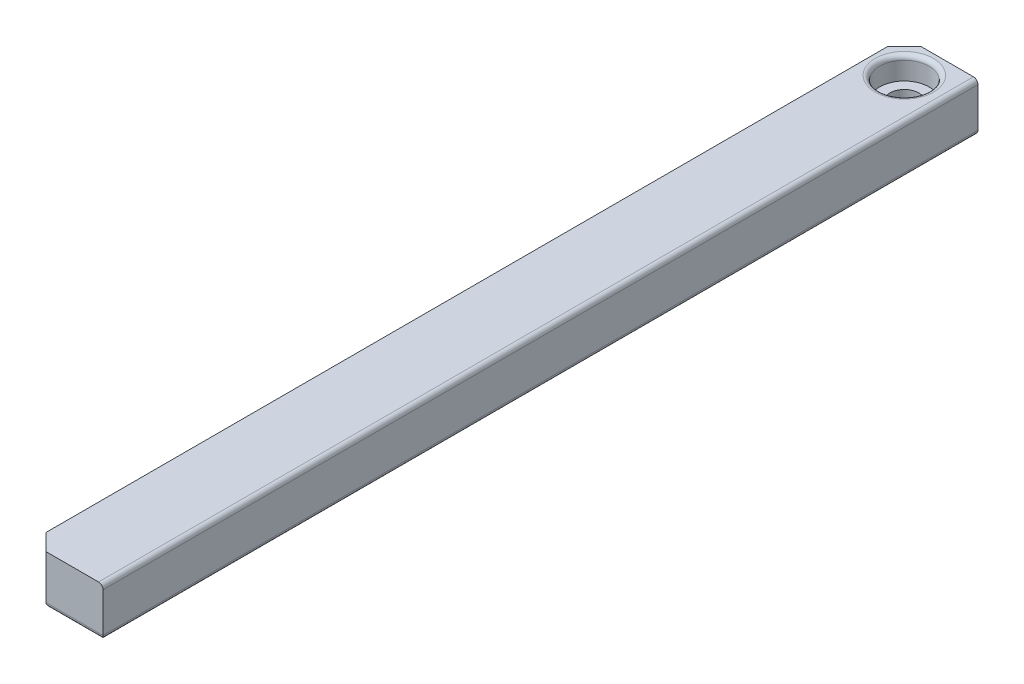
from build123d import *

# Parameters (mm, degrees)
SKETCH_1_W          = 8.2
SKETCH_1_H          = 97.4
EXTRUDE_1_DEPTH     = 5.4
SKETCH_2_R          = 1.6
CUT_EXTRUDE_1_DEPTH = 103.046451594
FILLET_1_R          = 0.5
FILLET_2_R          = 0.5
SKETCH_3_R          = 2.75
CUT_EXTRUDE_2_DEPTH = 2.5
FILLET_3_R          = 0.5


with BuildPart() as part:
    # 草图1 → 凸台-拉伸1 (new body)
    with BuildSketch(Plane(origin=(0, 0, 0), x_dir=(1, 0, 0), z_dir=(0, 1, 0))):
        with Locations((25.859277076, 48.7)):
            Rectangle(SKETCH_1_W, SKETCH_1_H)
    extrude(amount=EXTRUDE_1_DEPTH)

    # 草图2 → 切除-拉伸1 (cut, through all)
    with BuildSketch(Plane(origin=(0, 5.4, 0), x_dir=(1, 0, 0), z_dir=(0, 1, 0))):
        with Locations(Location((25.459277076, 93.7, 0), (0, 0, 270))):
            Circle(SKETCH_2_R)
        Polygon((21.759277076, 97.4), (23.609277076, 97.4), (21.759277076, 95.55), align=None)
        Polygon((21.759277076, 0), (23.609277076, 0), (21.759277076, 1.85), align=None)
    extrude(amount=-CUT_EXTRUDE_1_DEPTH, mode=Mode.SUBTRACT)

    # 圆角1
    fillet_1_edges = [part.edges().sort_by_distance(p)[0] for p in [
        (21.759277076, 0, -48.7),
        (26.784277076, 0, 0),
        (22.684277076, 0, -96.475),
        (22.684277076, 0, -0.925),
        (25.459277076, 0, -95.3),
        (26.784277076, 0, -97.4),
        (29.959277076, 0, -48.7),
    ]]
    fillet(fillet_1_edges, radius=FILLET_1_R)

    # 圆角2
    fillet_2_edges = [part.edges().sort_by_distance(p)[0] for p in [
        (29.959277076, 5.4, -48.7),
    ]]
    fillet(fillet_2_edges, radius=FILLET_2_R)

    # 草图3 → 切除-拉伸2 (cut)
    with BuildSketch(Plane(origin=(0, 5.4, 0), x_dir=(1, 0, 0), z_dir=(0, 1, 0))):
        with Locations(Location((25.459277076, 93.7, 0), (0, 0, 270))):
            Circle(SKETCH_3_R)
    extrude(amount=-CUT_EXTRUDE_2_DEPTH, mode=Mode.SUBTRACT)

    # 圆角3
    fillet_3_edges = [part.edges().sort_by_distance(p)[0] for p in [
        (25.459277076, 5.4, -96.45),
    ]]
    fillet(fillet_3_edges, radius=FILLET_3_R)


solid = part.part
